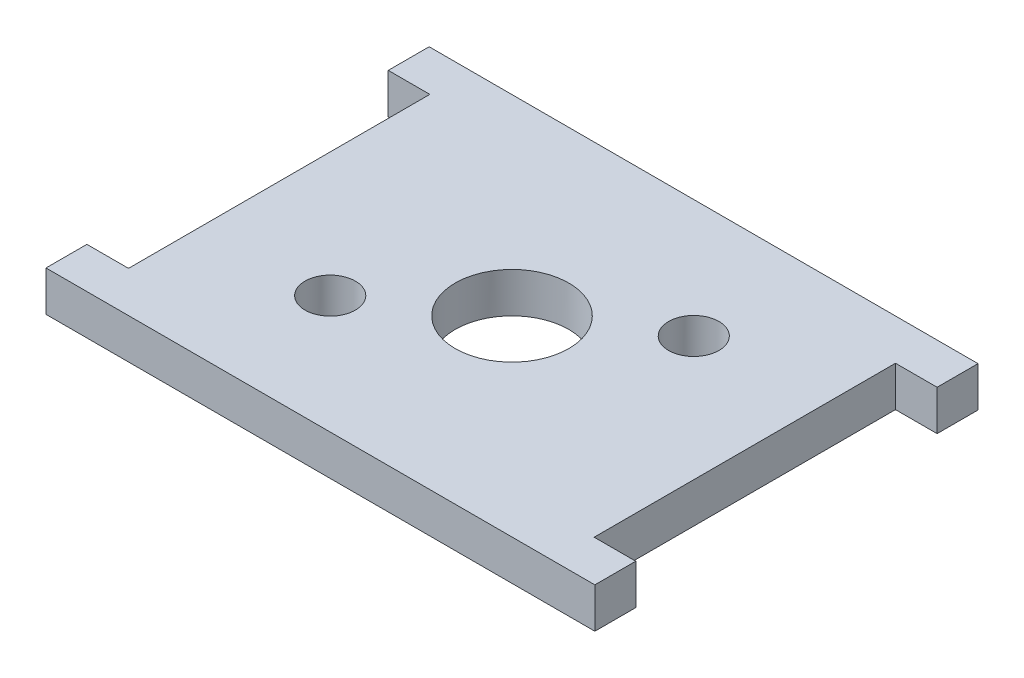
from build123d import *

# Parameters (mm, degrees)
SKETCH1_W           = 39.878
SKETCH1_H           = 27.8384
BOSS_EXTRUDE1_DEPTH = 2.921
CUT_EXTRUDE2_REACH  = 50.721
SKETCH3_W           = 3.0226
SKETCH3_H           = 21.8948
CUT_EXTRUDE1_REACH  = 50.721
SKETCH2_R           = 4.1275
SKETCH2_R_2         = 1.8288


with BuildPart() as part:
    # Sketch1 → Boss-Extrude1 (new body)
    with BuildSketch(Plane(origin=(0, 0, 0), x_dir=(1, 0, 0), z_dir=(0, 1, 0))):
        with Locations((19.939, 13.9192)):
            Rectangle(SKETCH1_W, SKETCH1_H)
    extrude(amount=BOSS_EXTRUDE1_DEPTH)

    # Sketch3 → Cut-Extrude2 (cut, up to next)
    with BuildSketch(Plane(origin=(0, 2.921, 0), x_dir=(1, 0, 0), z_dir=(0, 1, 0)), mode=Mode.PRIVATE) as cut_extrude2_sk1:
        with Locations((1.5113, 13.9192)):
            Rectangle(SKETCH3_W, SKETCH3_H)
    cut_extrude2_tool1 = extrude(cut_extrude2_sk1.sketch, amount=-CUT_EXTRUDE2_REACH, mode=Mode.PRIVATE) & part.part
    # Sketch3 → Cut-Extrude2 (cut, up to next)
    with BuildSketch(Plane(origin=(0, 2.921, 0), x_dir=(1, 0, 0), z_dir=(0, 1, 0)), mode=Mode.PRIVATE) as cut_extrude2_sk2:
        with Locations((38.3667, 13.9192)):
            Rectangle(SKETCH3_W, SKETCH3_H)
    cut_extrude2_tool2 = extrude(cut_extrude2_sk2.sketch, amount=-CUT_EXTRUDE2_REACH, mode=Mode.PRIVATE) & part.part
    add(cut_extrude2_tool1.solids().sort_by_distance((1.5113, 2.921, -13.9192))[0], mode=Mode.SUBTRACT)
    add(cut_extrude2_tool2.solids().sort_by_distance((38.3667, 2.921, -13.9192))[0], mode=Mode.SUBTRACT)

    # Sketch2 → Cut-Extrude1 (cut, up to next)
    with BuildSketch(Plane(origin=(0, 2.921, 0), x_dir=(1, 0, 0), z_dir=(0, 1, 0)), mode=Mode.PRIVATE) as cut_extrude1_sk1:
        with Locations(Location((19.939, 13.9192, 0), (0, 0, 270))):
            Circle(SKETCH2_R)
    cut_extrude1_tool1 = extrude(cut_extrude1_sk1.sketch, amount=-CUT_EXTRUDE1_REACH, mode=Mode.PRIVATE) & part.part
    # Sketch2 → Cut-Extrude1 (cut, up to next)
    with BuildSketch(Plane(origin=(0, 2.921, 0), x_dir=(1, 0, 0), z_dir=(0, 1, 0)), mode=Mode.PRIVATE) as cut_extrude1_sk2:
        with Locations(Location((12.065, 8.5852, 0), (0, 0, 270))):
            Circle(SKETCH2_R_2)
    cut_extrude1_tool2 = extrude(cut_extrude1_sk2.sketch, amount=-CUT_EXTRUDE1_REACH, mode=Mode.PRIVATE) & part.part
    # Sketch2 → Cut-Extrude1 (cut, up to next)
    with BuildSketch(Plane(origin=(0, 2.921, 0), x_dir=(1, 0, 0), z_dir=(0, 1, 0)), mode=Mode.PRIVATE) as cut_extrude1_sk3:
        with Locations(Location((27.813, 19.2532, 0), (0, 0, 270))):
            Circle(SKETCH2_R_2)
    cut_extrude1_tool3 = extrude(cut_extrude1_sk3.sketch, amount=-CUT_EXTRUDE1_REACH, mode=Mode.PRIVATE) & part.part
    add(cut_extrude1_tool1.solids().sort_by_distance((19.939, 2.921, -13.9192))[0], mode=Mode.SUBTRACT)
    add(cut_extrude1_tool2.solids().sort_by_distance((12.065, 2.921, -8.5852))[0], mode=Mode.SUBTRACT)
    add(cut_extrude1_tool3.solids().sort_by_distance((27.813, 2.921, -19.2532))[0], mode=Mode.SUBTRACT)


solid = part.part
